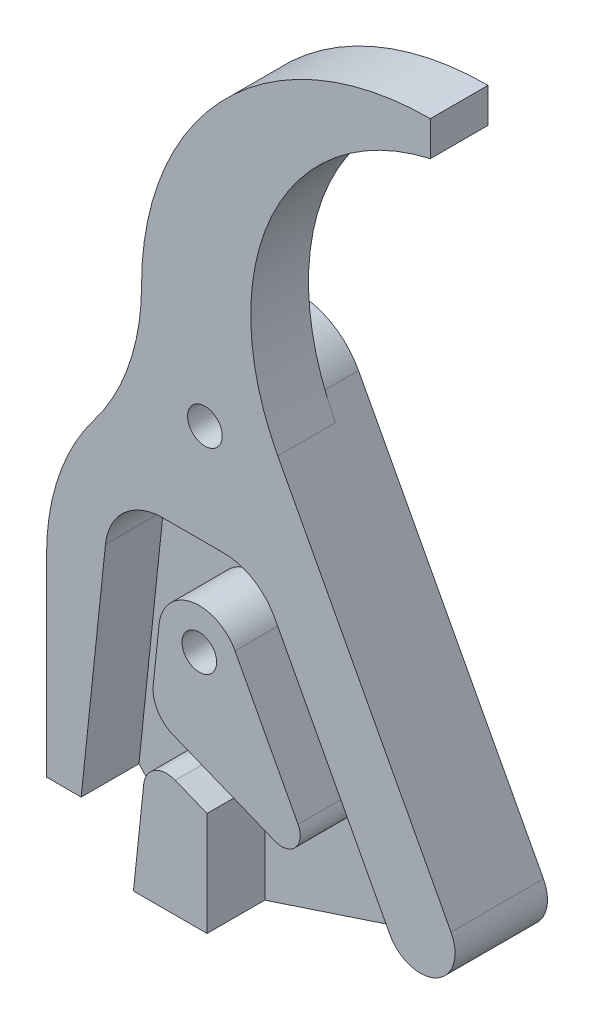
from build123d import *

# Parameters (mm, degrees)
CROQUIS4_R                = 1.5
SALIENTE_EXTRUIR1_DEPTH   = 5
SALIENTE_EXTRUIR1_2_DEPTH = 5
SALIENTE_EXTRUIR1_3_DEPTH = 5
SALIENTE_EXTRUIR2_START   = -3
CROQUIS5_R                = 1.5
SALIENTE_EXTRUIR2_DEPTH   = 3


with BuildPart() as part:
    # Croquis4 → Saliente-Extruir1 (new body)
    with BuildSketch(Plane.XY):
        with BuildLine():
            Line((31.332082611, 76.5), (31.332082611, 73.5))
            ThreePointArc((31.332082611, 73.5), (17.593960897, 62.317888205), (18.123970441, 44.612106598))
            Line((18.123970441, 44.612106598), (33.120139436, 16.408414688))
            ThreePointArc((33.120139436, 16.408414688), (31.879711346, 12.351157221), (27.822453879, 13.591585312))
            Line((27.822453879, 13.591585312), (17.849832742, 32.347357814))
            ThreePointArc((17.849832742, 32.347357814), (16.010285152, 34.285836504), (13.435094777, 35))
            Line((13.435094777, 35), (8.180668456, 35))
            ThreePointArc((8.180668456, 35), (4.835015424, 33.715724127), (3.208058979, 30.522642316))
            Line((3.208058979, 30.522642316), (1.105974274, 10.522642316))
            Line((1.105974274, 10.522642316), (-1.894025726, 10.522642316))
            Line((-1.894025726, 10.522642316), (-1.894025726, 27.20144431))
            ThreePointArc((-1.894025726, 27.20144431), (-0.837875871, 33.61475404), (2.219028442, 39.350722155))
            ThreePointArc((2.219028442, 39.350722155), (5.275932756, 45.086690271), (6.332082611, 51.5))
            ThreePointArc((6.332082611, 51.5), (13.654413081, 69.17766953), (31.332082611, 76.5))
        make_face()
        with Locations((11.817302712, 43.692896695)):
            Circle(CROQUIS4_R, mode=Mode.SUBTRACT)
    extrude(amount=SALIENTE_EXTRUIR1_DEPTH)



with BuildPart() as body_2:
    # Croquis4 → Saliente-Extruir1 2 (new body)
    with BuildSketch(Plane.XY):
        with BuildLine():
            Line((7.851255977, 26.865849621), (7.341304596, 22.013986331))
            ThreePointArc((7.341304596, 22.013986331), (7.719149951, 20.309636075), (9.046614258, 19.17587445))
            Line((9.046614258, 19.17587445), (17.853810231, 15.617536301))
            ThreePointArc((17.853810231, 15.617536301), (19.658030518, 16.034073375), (19.883693385, 17.871949935))
            Line((19.883693385, 17.871949935), (14.422399186, 28.14315047))
            ThreePointArc((14.422399186, 28.14315047), (10.664251127, 29.935695142), (7.851255977, 26.865849621))
        make_face()
        with Locations((11.332082611, 26.5)):
            Circle(CROQUIS4_R, mode=Mode.SUBTRACT)
    extrude(amount=SALIENTE_EXTRUIR1_2_DEPTH)


with BuildPart() as body_3:
    # Croquis4 → Saliente-Extruir1 3 (new body)
    with BuildSketch(Plane.XY):
        with BuildLine():
            Line((6.52097346, 14.209056927), (5.631578058, 5.747024927))
            Line((5.631578058, 5.747024927), (12, 5.747024927))
            Line((12, 5.747024927), (12, 14.747024927))
            Line((12, 14.747024927), (9.259230437, 15.854367709))
            ThreePointArc((9.259230437, 15.854367709), (7.479941101, 15.714334601), (6.52097346, 14.209056927))
        make_face()
    extrude(amount=SALIENTE_EXTRUIR1_3_DEPTH)


with BuildPart() as part_1:
    add(part.part)

    add(body_2.part)  # Saliente-Extruir2 merges body 2

    add(body_3.part)  # Saliente-Extruir2 merges body 3
    # Croquis5 → Saliente-Extruir2 (add)
    with BuildSketch(Plane.XY.offset(SALIENTE_EXTRUIR2_START)):
        with BuildLine():
            Line((12, 5.747024927), (31.411206338, 12.151040577))
            ThreePointArc((31.411206338, 12.151040577), (33.255375434, 13.882455653), (33.120139436, 16.408414688))
            Line((33.120139436, 16.408414688), (17.114988269, 46.509726071))
            ThreePointArc((17.114988269, 46.509726071), (11.909057427, 49.692195076), (6.608237363, 46.670418851))
            Line((6.608237363, 46.670418851), (3.695633773, 41.574926144))
            ThreePointArc((3.695633773, 41.574926144), (2.994485151, 40.43815831), (2.219028442, 39.350722155))
            ThreePointArc((2.219028442, 39.350722155), (-0.837875871, 33.61475404), (-1.894025726, 27.20144431))
            Line((-1.894025726, 27.20144431), (-1.894025726, 10.522642316))
            Line((-1.894025726, 10.522642316), (1.105974274, 10.522642316))
            Line((1.105974274, 10.522642316), (5.631578058, 5.747024927))
            Line((5.631578058, 5.747024927), (12, 5.747024927))
        make_face()
        with Locations((11.332082611, 26.5)):
            Circle(CROQUIS5_R, mode=Mode.SUBTRACT)
        with Locations((11.817302712, 43.692896695)):
            Circle(CROQUIS5_R, mode=Mode.SUBTRACT)
    extrude(amount=SALIENTE_EXTRUIR2_DEPTH)


solid = part_1.part
